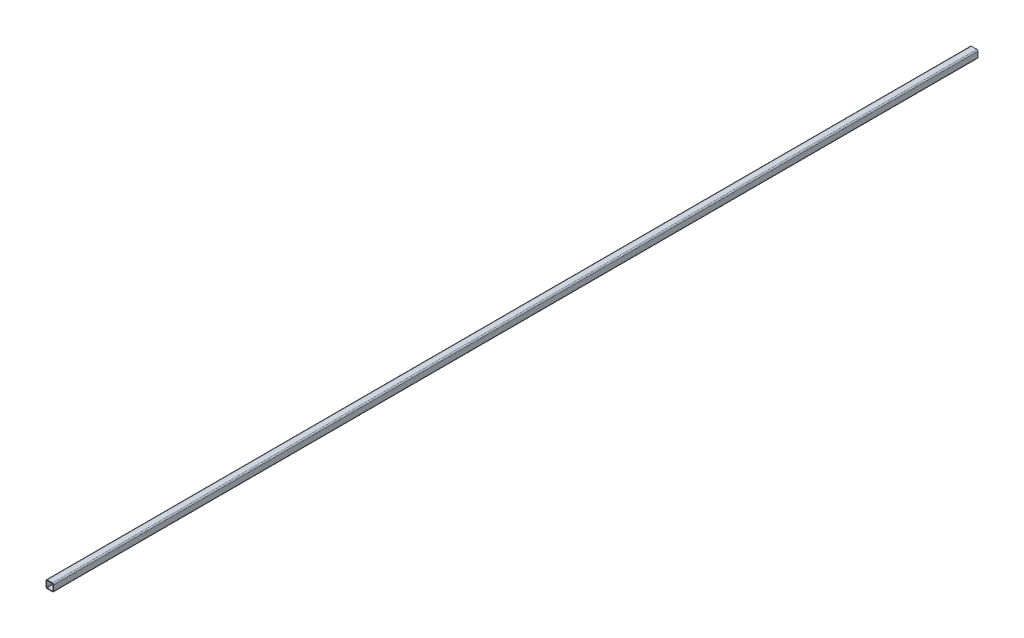
from build123d import *

# Parameters (mm, degrees)
BOSS_EXTRUDE1_DEPTH = 1524


with BuildPart() as part:
    # Sketch1 → Boss-Extrude1 (new body)
    with BuildSketch(Plane.XY):
        with BuildLine():
            Line((0.99999933, 2), (9.69999933, 2))
            ThreePointArc((9.69999933, 2), (11.114212892, 1.414213562), (11.69999933, 0))
            Line((11.69999933, 0), (11.69999933, -8.700000007))
            ThreePointArc((11.69999933, -8.700000007), (11.114212892, -10.114213569), (9.69999933, -10.700000007))
            Line((9.69999933, -10.700000007), (0.99999933, -10.700000007))
            ThreePointArc((0.99999933, -10.700000007), (-0.414214233, -10.114213569), (-1.00000067, -8.700000007))
            Line((-1.00000067, -8.700000007), (-1.00000067, 0))
            ThreePointArc((-1.00000067, 0), (-0.414214233, 1.414213562), (0.99999933, 2))
        make_face()
        with BuildLine():
            Line((9.69999933, 1), (1, 1))
            ThreePointArc((1, 1), (0.292893219, 0.707106781), (0, 0))
            Line((0, 0), (0, -8.700000007))
            ThreePointArc((0, -8.700000007), (0.292893219, -9.407106788), (1, -9.700000007))
            Line((1, -9.700000007), (9.69999933, -9.700000007))
            ThreePointArc((9.69999933, -9.700000007), (10.407106111, -9.407106788), (10.69999933, -8.700000007))
            Line((10.69999933, -8.700000007), (10.69999933, 0))
            ThreePointArc((10.69999933, 0), (10.407106111, 0.707106781), (9.69999933, 1))
        make_face(mode=Mode.SUBTRACT)
    extrude(amount=BOSS_EXTRUDE1_DEPTH)


solid = part.part
